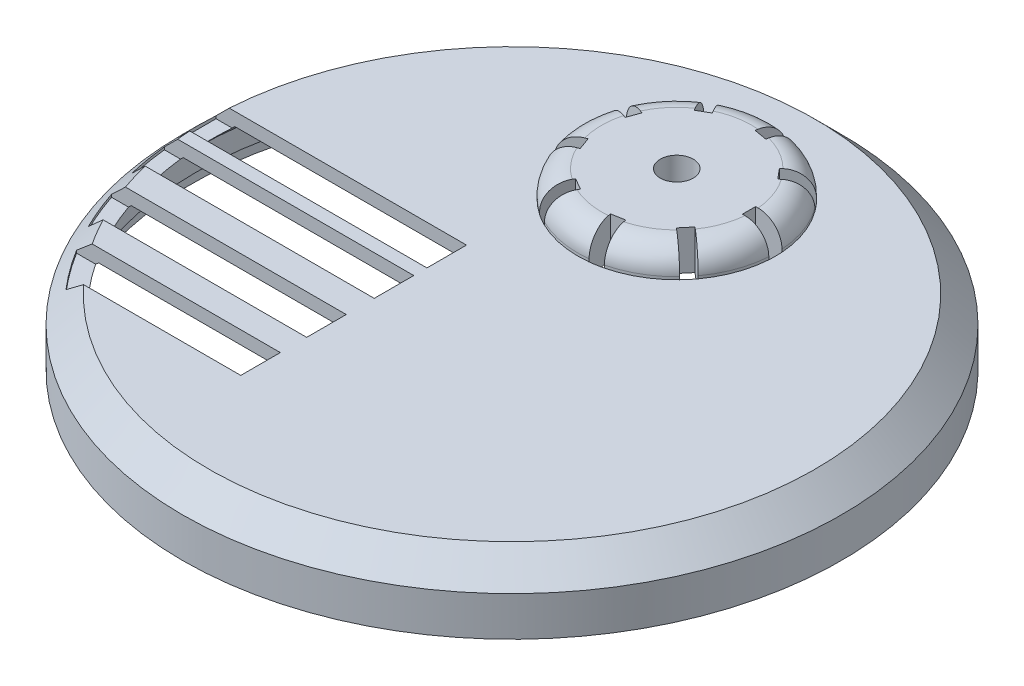
from build123d import *

# Parameters (mm, degrees)
SKETCH1_R           = 31.75
BOSS_EXTRUDE1_DEPTH = 6.35
CHAMFER2_SIZE       = 2.54
SKETCH2_R           = 9.525
SKETCH2_R_2         = 1.5875
BOSS_EXTRUDE2_DEPTH = 2.54
SKETCH2_2_R         = 1.5875
CUT_EXTRUDE1_DEPTH  = 46.348070521
FILLET1_R           = 2.286
CUT_EXTRUDE4_DEPTH  = 46.772886079
CIRPATTERN1_COUNT   = 9
SKETCH5_W           = 24.13
SKETCH5_H           = 3.81
CUT_EXTRUDE5_DEPTH  = 1.524


with BuildPart() as part:
    # Sketch1 → Boss-Extrude1 (new body)
    with BuildSketch(Plane(origin=(0, 0, 0), x_dir=(1, 0, 0), z_dir=(0, 1, 0))):
        Circle(SKETCH1_R)
    extrude(amount=BOSS_EXTRUDE1_DEPTH)

    # Chamfer2
    chamfer2_edges = [part.edges().sort_by_distance(p)[0] for p in [
        (-31.75, 6.35, 0),
    ]]
    chamfer(chamfer2_edges, length=CHAMFER2_SIZE)

    # Sketch2 → Boss-Extrude2 (add)
    with BuildSketch(Plane(origin=(0, 6.35, 0), x_dir=(1, 0, 0), z_dir=(0, 1, 0))):
        with Locations((0, 15.875)):
            Circle(SKETCH2_R)
        with Locations((0, 15.875)):
            Circle(SKETCH2_R_2, mode=Mode.SUBTRACT)
    extrude(amount=BOSS_EXTRUDE2_DEPTH)

    # Sketch2<2> → Cut-Extrude1 (cut, through all)
    with BuildSketch(Plane(origin=(0, 6.35, 0), x_dir=(1, 0, 0), z_dir=(0, 1, 0))):
        with Locations((0, 15.875)):
            Circle(SKETCH2_2_R)
    extrude(amount=-CUT_EXTRUDE1_DEPTH, mode=Mode.SUBTRACT)

    # Fillet1
    fillet1_edges = [part.edges().sort_by_distance(p)[0] for p in [
        (-9.525, 8.89, -15.875),
    ]]
    fillet(fillet1_edges, radius=FILLET1_R)

    # Sketch4 → Cut-Extrude4 (cut, through all)
    with BuildSketch(Plane(origin=(0, 8.89, 0), x_dir=(1, 0, 0), z_dir=(0, 1, 0))):
        with BuildLine():
            Line((9.503809762, 16.51), (6.963809762, 16.51))
            Line((6.963809762, 16.51), (6.963809762, 15.24))
            Line((6.963809762, 15.24), (9.503809762, 15.24))
            ThreePointArc((9.503809762, 15.24), (9.525, 15.875), (9.503809762, 16.51))
        make_face()
    cut_extrude4 = extrude(amount=-CUT_EXTRUDE4_DEPTH, mode=Mode.SUBTRACT)

    # CirPattern1: Cut-Extrude4 ×9 about axis
    cirpattern1_axis = Axis((0, 8.89, -15.875), (0, 1, 0))
    for i in range(1, CIRPATTERN1_COUNT):
        add(cut_extrude4.rotate(cirpattern1_axis, i * 360 / CIRPATTERN1_COUNT), mode=Mode.SUBTRACT)

    # Sketch5 → Cut-Extrude5 (cut)
    with BuildSketch(Plane(origin=(0, 6.35, 0), x_dir=(1, 0, 0), z_dir=(0, 1, 0))):
        with Locations((-18.3554105, 0)):
            Rectangle(SKETCH5_W, SKETCH5_H)
        with BuildLine():
            Line((-6.2904105, -3.175), (-6.2904105, -6.985))
            Line((-6.2904105, -6.985), (-29.668841821, -6.985))
            ThreePointArc((-29.668841821, -6.985), (-30.053265488, -5.090106258), (-30.319295317, -3.175))
            Line((-30.319295317, -3.175), (-6.2904105, -3.175))
        make_face()
        with BuildLine():
            Line((-6.2904105, -13.493377405), (-6.2904105, -9.683377405))
            Line((-6.2904105, -9.683377405), (-28.900910055, -9.683377405))
            ThreePointArc((-28.900910055, -9.683377405), (-28.18019525, -11.614947079), (-27.330553712, -13.493377405))
            Line((-27.330553712, -13.493377405), (-6.2904105, -13.493377405))
        make_face()
        with BuildLine():
            Line((-6.2904105, -16.033377405), (-6.2904105, -19.843377405))
            Line((-6.2904105, -19.843377405), (-23.135919544, -19.843377405))
            ThreePointArc((-23.135919544, -19.843377405), (-24.602929827, -17.992394058), (-25.922214585, -16.033377405))
            Line((-25.922214585, -16.033377405), (-6.2904105, -16.033377405))
        make_face()
    extrude(amount=-CUT_EXTRUDE5_DEPTH, mode=Mode.SUBTRACT)

    # Sketch6 → Cut-Revolve1 (revolve, cut)
    with BuildSketch(Plane(origin=(0, 0, 0), x_dir=(0, 0, -1), z_dir=(1, 0, 0))):
        Polygon((-30.48, 3.283948776), (-28.683948776, 5.08), (0, 5.08), (0, -0.561099899), (-30.990180808, -0.561099899), (-30.990180808, 1.27), (-30.48, 1.27), align=None)
    revolve(axis=Axis((0, 0, 0), (0, -1, 0)), mode=Mode.SUBTRACT)


solid = part.part
